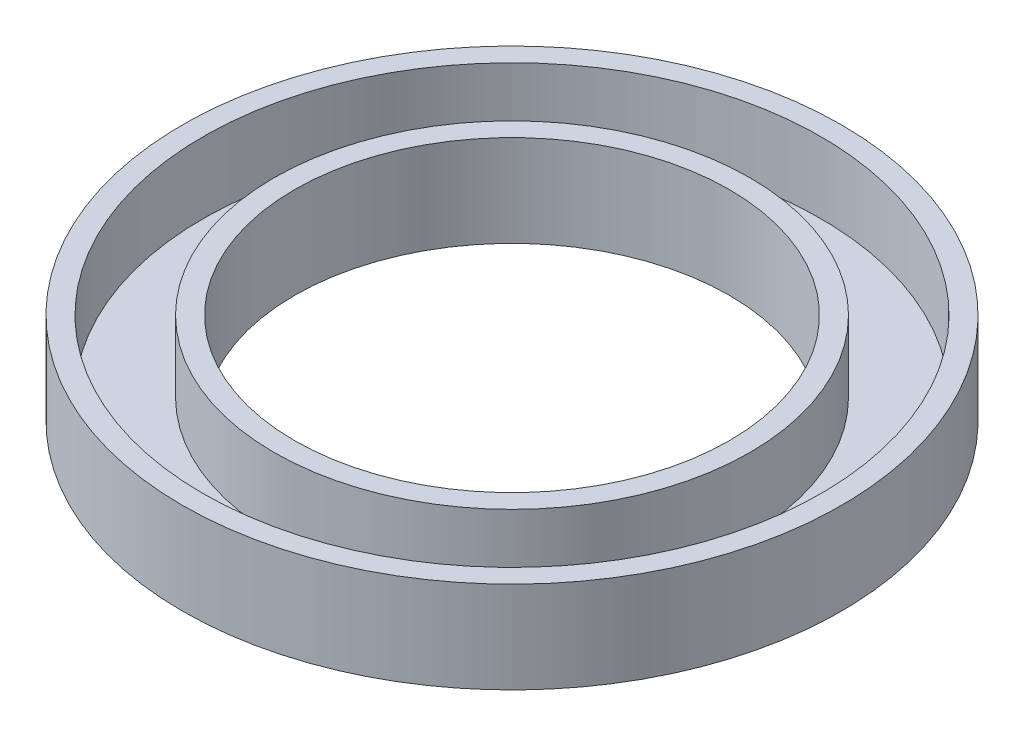
from build123d import *


with BuildPart() as part:
    # 草图1 → 旋转1 (revolve)
    with BuildSketch(Plane.XY, mode=Mode.PRIVATE) as revolve_1_sk:
        Polygon((17.4, 1.957736448), (17.4, -3.242263552), (22.6, -3.242263552), (22.6, 1.957736448), (24.1, 1.957736448), (24.1, -4.742263552), (15.9, -4.742263552), (15.9, 1.957736448), align=None)
    revolve(revolve_1_sk.sketch.rotate(Axis((0, 32.54180602, 0), (0, -1, 0)), 90), axis=Axis((0, 32.54180602, 0), (0, -1, 0)))


solid = part.part
